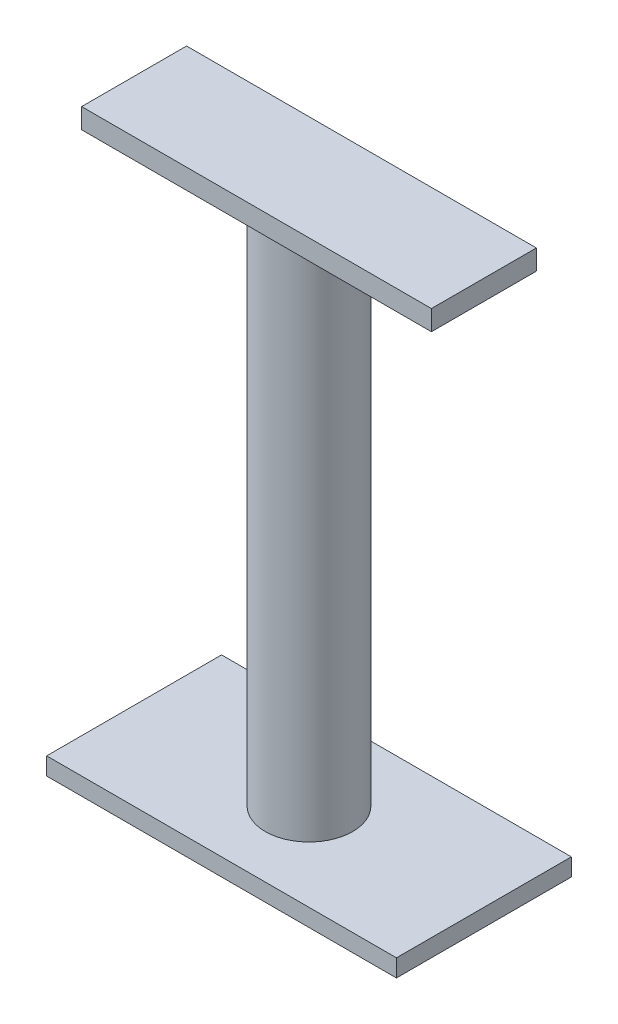
from build123d import *

# Parameters (mm, degrees)
BASE_START       = -160
SKETCH_6_W       = 200
SKETCH_6_H       = 100
BASE_PLATE_DEPTH = 10
POST_START       = 150
SKETCH_7_R       = 25
POST_DEPTH       = 300
TOP_START        = 150
SKETCH_8_W       = 200
SKETCH_8_H       = 60
TOP_PLATE_DEPTH  = 11.5


with BuildPart() as part:
    # 草图6 → Base Plate (new body)
    with BuildSketch(Plane(origin=(0, 0, 0), x_dir=(1, 0, 0), z_dir=(0, 1, 0)).offset(BASE_START)):
        Rectangle(SKETCH_6_W, SKETCH_6_H)
    extrude(amount=BASE_PLATE_DEPTH)

    # 草图7 → Post (add)
    with BuildSketch(Plane(origin=(0, 0, 0), x_dir=(1, 0, 0), z_dir=(0, 1, 0)).offset(POST_START)):
        with Locations(Location((0, 0, 0), (0, 0, 270))):
            Circle(SKETCH_7_R)
    extrude(amount=-POST_DEPTH)

    # 草图8 → Top Plate (add)
    with BuildSketch(Plane(origin=(0, 0, 0), x_dir=(1, 0, 0), z_dir=(0, 1, 0)).offset(TOP_START)):
        Rectangle(SKETCH_8_W, SKETCH_8_H)
    extrude(amount=TOP_PLATE_DEPTH)


solid = part.part
